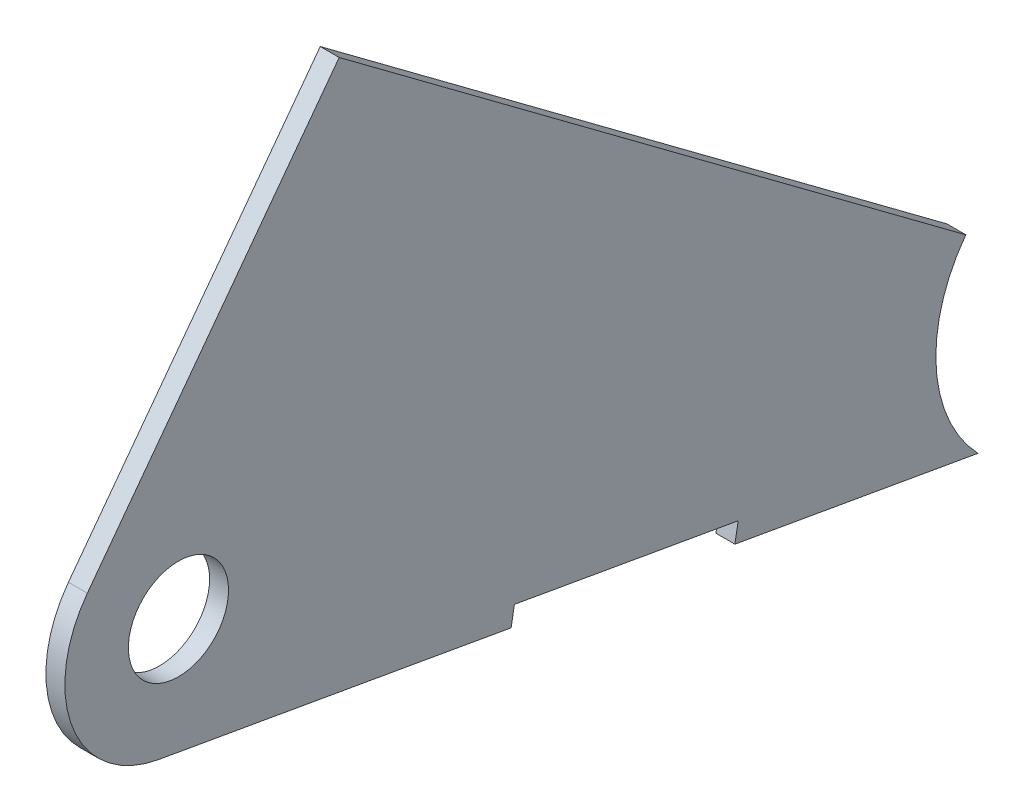
from build123d import *

# Parameters (mm, degrees)
BOSS_EXTRUDE1_DEPTH  = 1.5875
M8_CLEARANCE_HOLE1_D = 8.4


with BuildPart() as part:
    # Sketch1 → Boss-Extrude1 (new body)
    with BuildSketch(Plane(origin=(0, 0, 0), x_dir=(0, 0, -1), z_dir=(1, 0, 0))):
        with BuildLine():
            ThreePointArc((-7.638168997, 5.690694103), (-8.852669963, -3.515090259), (-1.653998892, -9.380293847))
            Line((-1.653998892, -9.380293847), (27.892706706, -14.590175236))
            Line((27.892706706, -14.590175236), (28.168373188, -13.026792928))
            Line((28.168373188, -13.026792928), (46.928960883, -16.334790712))
            Line((46.928960883, -16.334790712), (46.653294401, -17.89817302))
            Line((46.653294401, -17.89817302), (67.035446451, -21.492096351))
            ThreePointArc((67.035446451, -21.492096351), (63.524537099, -13.489075558), (66.01577467, -5.112407863))
            Line((66.01577467, -5.112407863), (13.47644349, 34.0311699))
            Line((13.47644349, 34.0311699), (-7.638168997, 5.690694103))
        make_face()
    extrude(amount=BOSS_EXTRUDE1_DEPTH)

    # M8 Clearance Hole1 (through all)
    with Locations(Plane(origin=(1.5875, 0, 0), x_dir=(0, 0, -1), z_dir=(1, 0, 0))):
        with Locations((0, 0)):
            Hole(M8_CLEARANCE_HOLE1_D / 2)


solid = part.part
